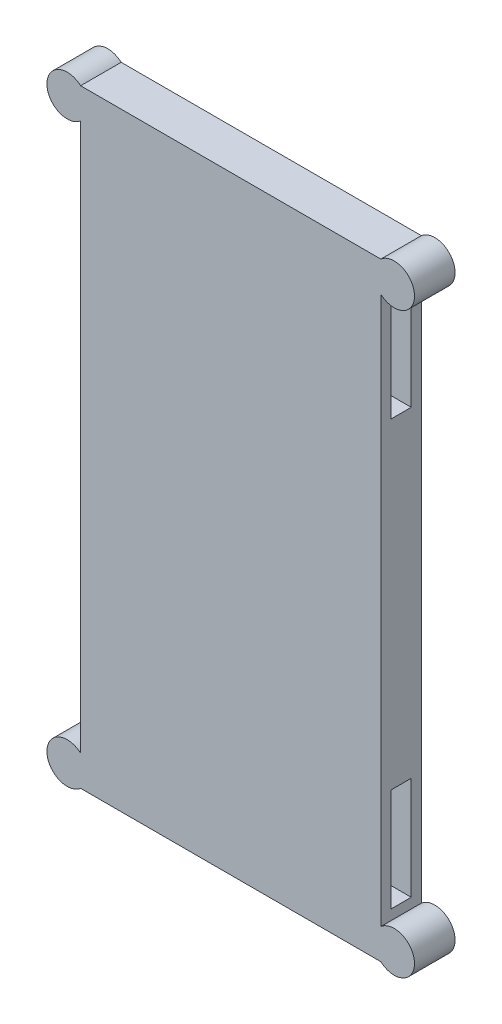
from build123d import *

# Parameters (mm, degrees)
SKETCH1_W           = 148
SKETCH1_H           = 300
BOSS_EXTRUDE1_DEPTH = 20
BOSS_EXTRUDE2_DEPTH = 20
SKETCH4_R           = 2.5
CUT_EXTRUDE2_DEPTH  = 10
CUT_EXTRUDE3_REACH  = 346.97
SKETCH5_W           = 10
SKETCH5_H           = 50.8
SKETCH7_W           = 13.921153846
SKETCH7_H           = 3.419230769
CUT_EXTRUDE4_DEPTH  = 5


with BuildPart() as part:
    # Sketch1 → Boss-Extrude1 (new body)
    with BuildSketch(Plane.XY):
        with Locations((74, 150)):
            Rectangle(SKETCH1_W, SKETCH1_H)
    extrude(amount=BOSS_EXTRUDE1_DEPTH)

    # Sketch3 → Boss-Extrude2 (add)
    with BuildSketch(Plane(origin=(0, 0, 0), x_dir=(-1, 0, 0), z_dir=(0, 0, -1))):
        with BuildLine():
            Line((0, 0), (0, 15))
            ThreePointArc((0, 15), (16.614378278, 7.5), (0, 0))
        make_face()
        with BuildLine():
            Line((-148, 0), (-148, 15))
            ThreePointArc((-148, 15), (-164.614378278, 7.5), (-148, 0))
        make_face()
        with BuildLine():
            Line((-148, 300), (-148, 285))
            ThreePointArc((-148, 285), (-164.614378278, 292.5), (-148, 300))
        make_face()
        with BuildLine():
            Line((0, 300), (0, 285))
            ThreePointArc((0, 285), (16.614378278, 292.5), (0, 300))
        make_face()
    extrude(amount=-BOSS_EXTRUDE2_DEPTH)

    # Sketch4 → Cut-Extrude2 (cut)
    with BuildSketch(Plane(origin=(0, 0, 0), x_dir=(-1, 0, 0), z_dir=(0, 0, -1))):
        with Locations((6.614378278, 7.5)):
            Circle(SKETCH4_R)
        with Locations((-154.614378278, 7.5)):
            Circle(SKETCH4_R)
        with Locations((-154.614378278, 292.5)):
            Circle(SKETCH4_R)
        with Locations((6.614378278, 292.5)):
            Circle(SKETCH4_R)
    extrude(amount=-CUT_EXTRUDE2_DEPTH, mode=Mode.SUBTRACT)

    # Sketch5 → Cut-Extrude3 (cut, up to next)
    with BuildSketch(Plane(origin=(148, 0, 0), x_dir=(0, 0, -1), z_dir=(1, 0, 0)), mode=Mode.PRIVATE) as cut_extrude3_sk1:
        with Locations((-10, 254.6)):
            Rectangle(SKETCH5_W, SKETCH5_H)
    cut_extrude3_tool1 = extrude(cut_extrude3_sk1.sketch, amount=-CUT_EXTRUDE3_REACH, mode=Mode.PRIVATE) & part.part
    # Sketch5 → Cut-Extrude3 (cut, up to next)
    with BuildSketch(Plane(origin=(148, 0, 0), x_dir=(0, 0, -1), z_dir=(1, 0, 0)), mode=Mode.PRIVATE) as cut_extrude3_sk2:
        with Locations((-10, 45.4)):
            Rectangle(SKETCH5_W, SKETCH5_H)
    cut_extrude3_tool2 = extrude(cut_extrude3_sk2.sketch, amount=-CUT_EXTRUDE3_REACH, mode=Mode.PRIVATE) & part.part
    add(cut_extrude3_tool1.solids().sort_by_distance((148, 254.6, 10))[0], mode=Mode.SUBTRACT)
    add(cut_extrude3_tool2.solids().sort_by_distance((148, 45.4, 10))[0], mode=Mode.SUBTRACT)

    # Sketch7 → Cut-Extrude4 (cut)
    # profile 1 of 9: a face of its own
    with BuildSketch(Plane(origin=(0, 0, 0), x_dir=(-1, 0, 0), z_dir=(0, 0, -1))):
        Polygon((-93.05, 102.863461538), (-93.05, 106.282692308), (-77.419230769, 106.282692308), (-77.419230769, 111.655769231), (-74, 111.655769231), (-74, 102.863461538), align=None)
    # profile 2 of 9: a face of its own
    with BuildSketch(Plane(origin=(0, 0, 0), x_dir=(-1, 0, 0), z_dir=(0, 0, -1))):
        with BuildLine():
            add(Edge.make_bspline(
                [(-93.782692308, 115.555829327), (-93.77554963, 115.703248556), (-93.761524294, 115.992720415), (-93.622067947, 116.405961185), (-93.410224894, 116.788787177), (-93.11106791, 117.123663252), (-92.755039073, 117.405017214), (-92.354069114, 117.616533357), (-91.911957927, 117.736721869), (-91.606943837, 117.753144754), (-91.451051683, 117.761538462)],
                knots=[0, 0, 0, 0, 0.989451283, 1.942882919, 2.90538868, 3.918974235, 4.943608841, 5.947266847, 6.950851762, 8, 8, 8, 8], degree=3))
            add(Edge.make_bspline(
                [(-91.451051683, 117.761538462), (-91.296406711, 117.753185623), (-90.993847324, 117.736843483), (-90.557395841, 117.616521461), (-90.160568566, 117.408267671), (-89.810493081, 117.127718929), (-89.517372558, 116.794803662), (-89.296196332, 116.422680626), (-89.165505232, 116.012074288), (-89.150119806, 115.727193377), (-89.142307692, 115.582542067)],
                knots=[0, 0, 0, 0, 1.052878812, 2.059933557, 3.056041729, 4.085953482, 5.099252665, 6.062359416, 7.016142401, 8, 8, 8, 8], degree=3))
            add(Edge.make_bspline(
                [(-89.142307692, 115.582542067), (-89.149599232, 115.433937151), (-89.163916458, 115.142145531), (-89.301585906, 114.72284999), (-89.522425405, 114.339628029), (-89.825413529, 114.003245964), (-90.183654835, 113.721876685), (-90.588872359, 113.515246638), (-91.032672705, 113.388510261), (-91.342082895, 113.373220756), (-91.500661058, 113.365384615)],
                knots=[0, 0, 0, 0, 0.989481277, 1.942885557, 2.912973099, 3.923546742, 4.946144057, 5.937372893, 6.942867345, 8, 8, 8, 8], degree=3))
            add(Edge.make_bspline(
                [(-91.500661058, 113.365384615), (-91.65274621, 113.373849729), (-91.951495536, 113.390478222), (-92.38313623, 113.510258509), (-92.774875041, 113.719099934), (-93.124245448, 113.996838953), (-93.416702005, 114.330246153), (-93.627314045, 114.710505337), (-93.759994158, 115.122281323), (-93.775048135, 115.40982113), (-93.782692308, 115.555829327)],
                knots=[0, 0, 0, 0, 1.038616768, 2.040212704, 3.031499824, 4.052181184, 5.074969369, 6.039807101, 7.004644834, 8, 8, 8, 8], degree=3))
        make_face()
    # profile 3 of 9: a face of its own
    with BuildSketch(Plane(origin=(0, 0, 0), x_dir=(-1, 0, 0), z_dir=(0, 0, -1))):
        with Locations((-80.960576923, 115.563461539)):
            Rectangle(SKETCH7_W, SKETCH7_H)
    # profile 4 of 9: a face of its own
    with BuildSketch(Plane(origin=(0, 0, 0), x_dir=(-1, 0, 0), z_dir=(0, 0, -1))):
        with BuildLine():
            Line((-87.921153846, 118.738461538), (-87.921153846, 119.959615385))
            add(Edge.make_bspline(
                [(-87.921153846, 119.959615385), (-88.142492377, 119.960431452), (-88.561013445, 119.961974524), (-89.153755707, 119.971087647), (-89.67534135, 119.977233074), (-90.125690144, 119.988210162), (-90.503482941, 120.003659244), (-90.808699091, 120.019496185), (-91.043264327, 120.031359117), (-91.175073425, 120.048084276), (-91.229717548, 120.055018029)],
                knots=[0, 0, 0, 0, 1.604323161, 3.033556972, 4.296844687, 5.385167547, 6.298701784, 7.037230881, 7.60086462, 8, 8, 8, 8], degree=3))
            add(Edge.make_bspline(
                [(-91.229717548, 120.055018029), (-91.417194642, 120.087531228), (-91.782650943, 120.150910456), (-92.292023019, 120.360716166), (-92.735744413, 120.665580775), (-93.048946429, 120.988755979), (-93.262761519, 121.288256541), (-93.402411804, 121.539512623), (-93.522134784, 121.812707831), (-93.616011951, 122.108724846), (-93.692697593, 122.424748357), (-93.746005649, 122.764188802), (-93.775383063, 123.125183896), (-93.780217059, 123.373705841), (-93.782692308, 123.500961538)],
                knots=[0, 0, 0, 0, 1.43722947, 2.801646624, 4.13175475, 5.486897933, 6.18427957, 6.91287343, 7.658885333, 8.438447905, 9.260561323, 10.118602268, 11.036630026, 12, 12, 12, 12], degree=3))
            add(Edge.make_bspline(
                [(-93.782692308, 123.500961538), (-93.776607767, 123.69593819), (-93.763934893, 124.102035344), (-93.661482502, 124.725970586), (-93.504644477, 125.387922346), (-93.358697321, 125.833576313), (-93.282782452, 126.065384615)],
                knots=[0, 0, 0, 0, 0.891275659, 1.856347963, 2.884972697, 4, 4, 4, 4], degree=3))
            Line((-93.282782452, 126.065384615), (-90.622956731, 126.065384615))
            add(Edge.make_bspline(
                [(-90.622956731, 126.065384615), (-90.657332936, 125.941050794), (-90.722896043, 125.70391841), (-90.795676916, 125.362722476), (-90.840618926, 125.055294591), (-90.848317933, 124.862161461), (-90.851923077, 124.77172476)],
                knots=[0, 0, 0, 0, 1.174725213, 2.24046353, 3.176077791, 4, 4, 4, 4], degree=3))
            add(Edge.make_bspline(
                [(-90.851923077, 124.77172476), (-90.850477897, 124.672034449), (-90.847766198, 124.484978062), (-90.789766349, 124.22859598), (-90.718128639, 124.005003631), (-90.62765172, 123.890849865), (-90.584795673, 123.836778846)],
                knots=[0, 0, 0, 0, 1.200739268, 2.253036902, 3.172518975, 4, 4, 4, 4], degree=3))
            add(Edge.make_bspline(
                [(-90.584795673, 123.836778846), (-90.542889653, 123.803973527), (-90.450305564, 123.731495858), (-90.261381717, 123.665618308), (-90.022598648, 123.632173009), (-89.845886811, 123.62629656), (-89.74906851, 123.623076923)],
                knots=[0, 0, 0, 0, 0.721105823, 1.593158367, 2.681320256, 4, 4, 4, 4], degree=3))
            Line((-89.74906851, 123.623076923), (-87.921153846, 123.611628606))
            Line((-87.921153846, 123.611628606), (-87.921153846, 125.821153846))
            Line((-87.921153846, 125.821153846), (-84.990384615, 125.821153846))
            Line((-84.990384615, 125.821153846), (-84.990384615, 123.378846154))
            Line((-84.990384615, 123.378846154), (-74, 123.378846154))
            Line((-74, 123.378846154), (-74, 119.959615385))
            Line((-74, 119.959615385), (-84.990384615, 119.959615385))
            Line((-84.990384615, 119.959615385), (-84.990384615, 118.738461538))
            Line((-84.990384615, 118.738461538), (-87.921153846, 118.738461538))
        make_face()
    # profile 5 of 9: a face of its own
    with BuildSketch(Plane(origin=(0, 0, 0), x_dir=(-1, 0, 0), z_dir=(0, 0, -1))):
        Polygon((-93.538461538, 128.019230769), (-93.538461538, 131.438461538), (-87.921153846, 131.438461538), (-87.921153846, 133.636538462), (-84.990384615, 133.636538462), (-84.990384615, 131.438461538), (-74, 131.438461538), (-74, 128.019230769), (-84.990384615, 128.019230769), (-84.990384615, 126.309615385), (-87.921153846, 126.309615385), (-87.921153846, 128.019230769), align=None)
    # profile 6 of 9: a face of its own
    with BuildSketch(Plane(origin=(0, 0, 0), x_dir=(-1, 0, 0), z_dir=(0, 0, -1))):
        Polygon((-93.05, 143.405769231), (-93.05, 146.825), (-77.419230769, 146.825), (-77.419230769, 152.198076923), (-74, 152.198076923), (-74, 143.405769231), align=None)
    # profile 7 of 9: a face of its own
    with BuildSketch(Plane(origin=(0, 0, 0), x_dir=(-1, 0, 0), z_dir=(0, 0, -1))):
        with BuildLine():
            Line((-87.921153846, 165.142307692), (-87.921153846, 168.561538462))
            Line((-87.921153846, 168.561538462), (-74, 168.561538462))
            Line((-74, 168.561538462), (-74, 165.142307692))
            Line((-74, 165.142307692), (-75.518810096, 165.142307692))
            add(Edge.make_bspline(
                [(-75.518810096, 165.142307692), (-75.371392836, 164.972595238), (-75.084796571, 164.642654526), (-74.706740062, 164.128384876), (-74.405546936, 163.605056585), (-74.15977222, 163.082901107), (-73.979547833, 162.546984182), (-73.848687137, 161.995442929), (-73.771602974, 161.419963803), (-73.761102122, 161.02877479), (-73.755769231, 160.830108173)],
                knots=[0, 0, 0, 0, 1.129123921, 2.195147974, 3.200207348, 4.157999811, 5.089597333, 6.035096005, 7.002117093, 8, 8, 8, 8], degree=3))
            add(Edge.make_bspline(
                [(-73.755769231, 160.830108173), (-73.760784318, 160.607093377), (-73.770694415, 160.1664035), (-73.875085276, 159.519763722), (-74.034726163, 158.895276557), (-74.261194496, 158.293888182), (-74.552910765, 157.714427002), (-74.910974186, 157.160147285), (-75.328910692, 156.625238765), (-75.811014704, 156.124872783), (-76.33489097, 155.660665192), (-76.899908199, 155.258312203), (-77.494758934, 154.91533794), (-78.122199716, 154.637588792), (-78.779999865, 154.417875677), (-79.470018211, 154.261473004), (-80.192287817, 154.169141803), (-80.684277735, 154.157718246), (-80.933864183, 154.151923077)],
                knots=[0, 0, 0, 0, 0.980565623, 1.937653242, 2.874408941, 3.813202629, 4.759425872, 5.723639668, 6.712366934, 7.741707894, 8.776921788, 9.78808311, 10.788528848, 11.79333378, 12.802261723, 13.835597484, 14.901998771, 16, 16, 16, 16], degree=3))
            add(Edge.make_bspline(
                [(-80.933864183, 154.151923077), (-81.192312715, 154.158001476), (-81.69928831, 154.169924932), (-82.443214175, 154.257283854), (-83.150414761, 154.410610395), (-83.822343029, 154.621270516), (-84.45920403, 154.887570855), (-85.058434612, 155.218756917), (-85.622185676, 155.610169701), (-86.144232665, 156.057215131), (-86.615906082, 156.547842385), (-87.028803622, 157.068515405), (-87.386243046, 157.611768822), (-87.666802396, 158.18828244), (-87.890028257, 158.786281862), (-88.051677909, 159.409906506), (-88.149070943, 160.059975622), (-88.159901564, 160.502860709), (-88.165384615, 160.727073317)],
                knots=[0, 0, 0, 0, 1.136200099, 2.228783096, 3.287341693, 4.313263682, 5.320819933, 6.317074962, 7.317731395, 8.33320375, 9.333922696, 10.3051871, 11.251461974, 12.186899125, 13.117710514, 14.053682506, 15.014667834, 16, 16, 16, 16], degree=3))
            add(Edge.make_bspline(
                [(-88.165384615, 160.727073317), (-88.161178611, 160.934787202), (-88.152856445, 161.345778109), (-88.058625072, 161.94915488), (-87.924375498, 162.536008597), (-87.724274506, 163.100916622), (-87.466819985, 163.646611196), (-87.151846181, 164.169196977), (-86.784842844, 164.675673538), (-86.498550128, 164.984841187), (-86.352734375, 165.142307692)],
                knots=[0, 0, 0, 0, 1.016860689, 2.012000776, 2.985574089, 3.963288254, 4.94189597, 5.937036056, 6.949282938, 8, 8, 8, 8], degree=3))
            Line((-86.352734375, 165.142307692), (-87.921153846, 165.142307692))
        make_face()
        with BuildLine():
            add(Edge.make_bspline(
                [(-84.990384615, 161.444501202), (-84.986202289, 161.308256027), (-84.978005201, 161.04122438), (-84.928746385, 160.6484992), (-84.841810266, 160.273243171), (-84.713863482, 159.917798469), (-84.556603259, 159.578690095), (-84.366051649, 159.255846371), (-84.13379569, 158.953901808), (-83.872607386, 158.669842858), (-83.585158405, 158.40912686), (-83.268999638, 158.189904266), (-82.939328677, 157.995261178), (-82.587519999, 157.838255479), (-82.21399635, 157.722025128), (-81.82290593, 157.631329251), (-81.410756266, 157.584039086), (-81.129857572, 157.575491902), (-80.987289663, 157.571153846)],
                knots=[0, 0, 0, 0, 1.048146026, 2.054297773, 3.039291333, 4.004895774, 4.954855183, 5.911393651, 6.882091317, 7.879305688, 8.877191939, 9.859995919, 10.833402353, 11.818978979, 12.815424932, 13.838562528, 14.902979527, 16, 16, 16, 16], degree=3))
            add(Edge.make_bspline(
                [(-80.987289663, 157.571153846), (-80.843430279, 157.575429408), (-80.55995703, 157.583854353), (-80.144306572, 157.632049119), (-79.747591057, 157.719669063), (-79.373326442, 157.847931965), (-79.016350567, 158.002642833), (-78.680406457, 158.19677967), (-78.3640117, 158.425035994), (-78.071347473, 158.688691957), (-77.806057934, 158.976589025), (-77.572292081, 159.283158817), (-77.370465062, 159.604755835), (-77.212571052, 159.945833693), (-77.082755679, 160.299787322), (-76.99709838, 160.672929751), (-76.942254396, 161.061263859), (-76.934624055, 161.326014454), (-76.930769231, 161.459765625)],
                knots=[0, 0, 0, 0, 1.099325991, 2.166209118, 3.191924645, 4.196940947, 5.184751095, 6.160002295, 7.155385631, 8.160260941, 9.164478025, 10.142244259, 11.102414478, 12.058888405, 13.008821923, 13.977708232, 14.978344536, 16, 16, 16, 16], degree=3))
            add(Edge.make_bspline(
                [(-76.930769231, 161.459765625), (-76.93497129, 161.59855077), (-76.943209609, 161.870645099), (-76.992071014, 162.26974571), (-77.079134418, 162.650158255), (-77.208509965, 163.009957183), (-77.362633218, 163.356494087), (-77.559826149, 163.681291632), (-77.789483921, 163.988531489), (-78.053706474, 164.272501667), (-78.339604472, 164.536995589), (-78.657276618, 164.761910433), (-78.992476752, 164.959336251), (-79.353704778, 165.114343574), (-79.734280412, 165.237512125), (-80.136664303, 165.325864547), (-80.56126302, 165.373927333), (-80.851069254, 165.382281602), (-80.998737981, 165.386538462)],
                knots=[0, 0, 0, 0, 1.050155102, 2.058874885, 3.037059141, 3.995876228, 4.947712252, 5.901735345, 6.864168349, 7.84500044, 8.832936864, 9.80518476, 10.78407896, 11.771077351, 12.772424026, 13.806938781, 14.882541092, 16, 16, 16, 16], degree=3))
            add(Edge.make_bspline(
                [(-80.998737981, 165.386538462), (-81.143868587, 165.382338429), (-81.42735082, 165.374134546), (-81.843060184, 165.325613918), (-82.237629891, 165.236833499), (-82.612354272, 165.115124392), (-82.967104538, 164.959307623), (-83.295073748, 164.760753919), (-83.608541831, 164.537087724), (-83.890009283, 164.272091671), (-84.15254531, 163.989348278), (-84.371615534, 163.676637174), (-84.56526991, 163.351668408), (-84.72335749, 163.006789168), (-84.839544175, 162.640755959), (-84.929417163, 162.259735073), (-84.97798232, 161.857878622), (-84.986183053, 161.584542292), (-84.990384615, 161.444501202)],
                knots=[0, 0, 0, 0, 1.106392033, 2.161105042, 3.184375597, 4.183944285, 5.160535686, 6.12997743, 7.101598623, 8.089721671, 9.071306002, 10.0372504, 10.99341283, 11.95232427, 12.921232515, 13.916134811, 14.932352853, 16, 16, 16, 16], degree=3))
        make_face(mode=Mode.SUBTRACT)
    # profile 8 of 9: a face of its own
    with BuildSketch(Plane(origin=(0, 0, 0), x_dir=(-1, 0, 0), z_dir=(0, 0, -1))):
        with BuildLine():
            Line((-93.538461538, 175.4), (-86.299308894, 175.4))
            add(Edge.make_bspline(
                [(-86.299308894, 175.4), (-86.448806689, 175.558772741), (-86.74227882, 175.870452087), (-87.121719628, 176.379349125), (-87.442158859, 176.906459237), (-87.710285864, 177.451524838), (-87.910996659, 178.018366543), (-88.057453381, 178.60339529), (-88.147214114, 179.206976155), (-88.159296098, 179.616495861), (-88.165384615, 179.822866587)],
                knots=[0, 0, 0, 0, 1.061273251, 2.083335899, 3.084058773, 4.061996401, 5.035766215, 6.006279825, 6.995297484, 8, 8, 8, 8], degree=3))
            add(Edge.make_bspline(
                [(-88.165384615, 179.822866587), (-88.160022384, 180.047100512), (-88.149460528, 180.488768587), (-88.050567852, 181.138521447), (-87.891373478, 181.761493382), (-87.666969751, 182.358103415), (-87.383924179, 182.931681472), (-87.031433645, 183.476945021), (-86.61432493, 183.994503869), (-86.144489763, 184.485307664), (-85.62207643, 184.931978398), (-85.058613584, 185.323967835), (-84.458158971, 185.653464642), (-83.824066544, 185.92700616), (-83.149495395, 186.130137046), (-82.443367796, 186.285482715), (-81.699247585, 186.372261111), (-81.192298964, 186.384265141), (-80.933864183, 186.390384615)],
                knots=[0, 0, 0, 0, 0.985918914, 1.941940352, 2.883887689, 3.810010177, 4.7409891, 5.692528817, 6.659995536, 7.661310393, 8.677387444, 9.67863975, 10.675488032, 11.68583178, 12.710700752, 13.769889703, 14.863123313, 16, 16, 16, 16], degree=3))
            add(Edge.make_bspline(
                [(-80.933864183, 186.390384615), (-80.684277742, 186.384589441), (-80.192287837, 186.373165874), (-79.470018135, 186.280834747), (-78.780000138, 186.124431806), (-78.122198724, 185.904719664), (-77.494762615, 185.626966918), (-76.899894463, 185.284006067), (-76.334943374, 184.881602145), (-75.810814495, 184.417589089), (-75.33033338, 183.917228999), (-74.90960616, 183.385744961), (-74.554219878, 182.832247865), (-74.260246632, 182.255298986), (-74.034122004, 181.653500566), (-73.876087807, 181.028701893), (-73.770330503, 180.382333127), (-73.760671331, 179.942865001), (-73.755769231, 179.719831731)],
                knots=[0, 0, 0, 0, 1.098654079, 2.165689428, 3.19963959, 4.209167422, 5.21456979, 6.215610373, 7.227372913, 8.263202325, 9.29315531, 10.278069275, 11.242856373, 12.184642801, 13.123994677, 14.066729874, 15.018851352, 16, 16, 16, 16], degree=3))
            add(Edge.make_bspline(
                [(-73.755769231, 179.719831731), (-73.761082171, 179.52116164), (-73.771543736, 179.129965787), (-73.849078815, 178.553306517), (-73.97962701, 177.999236573), (-74.158937623, 177.460383192), (-74.405638212, 176.937283844), (-74.706713593, 176.413913323), (-75.084803819, 175.899655766), (-75.371395298, 175.569713337), (-75.518810096, 175.4)],
                knots=[0, 0, 0, 0, 0.996354537, 1.961894523, 2.912155913, 3.848368634, 4.80469413, 5.808214142, 6.872605459, 8, 8, 8, 8], degree=3))
            Line((-75.518810096, 175.4), (-74, 175.4))
            Line((-74, 175.4), (-74, 171.980769231))
            Line((-74, 171.980769231), (-93.538461538, 171.980769231))
            Line((-93.538461538, 171.980769231), (-93.538461538, 175.4))
        make_face()
        with BuildLine():
            add(Edge.make_bspline(
                [(-84.990384615, 179.082542067), (-84.986118008, 178.943779162), (-84.977753137, 178.671728432), (-84.929803016, 178.272313858), (-84.839618511, 177.893840829), (-84.722620139, 177.5306519), (-84.565100287, 177.186991751), (-84.373052027, 176.86201823), (-84.14970502, 176.552810593), (-83.893082017, 176.265829686), (-83.605537706, 176.006355771), (-83.297751384, 175.776316446), (-82.965671995, 175.584069155), (-82.612586607, 175.426816321), (-82.23756546, 175.305575964), (-81.843078103, 175.216665471), (-81.427346024, 175.168180721), (-81.143866963, 175.159971828), (-80.998737981, 175.155769231)],
                knots=[0, 0, 0, 0, 1.06026186, 2.078689624, 3.066287985, 4.028070226, 4.989066778, 5.947308343, 6.907469395, 7.898408277, 8.88212702, 9.861613455, 10.828242951, 11.806957908, 12.808700115, 13.834195728, 14.891202165, 16, 16, 16, 16], degree=3))
            add(Edge.make_bspline(
                [(-80.998737981, 175.155769231), (-80.851070867, 175.160028692), (-80.561267797, 175.168388069), (-80.136646316, 175.216414117), (-79.734344201, 175.304898515), (-79.353476196, 175.427595212), (-78.993895774, 175.584070183), (-78.654625711, 175.775125572), (-78.342551166, 176.006447379), (-78.05081227, 176.265508954), (-77.79099561, 176.553956883), (-77.559577232, 176.86077095), (-77.362699478, 177.185878853), (-77.208492096, 177.532332915), (-77.079139322, 177.892154266), (-76.992069651, 178.27256064), (-76.943209971, 178.671662949), (-76.934971412, 178.943757043), (-76.930769231, 179.082542067)],
                knots=[0, 0, 0, 0, 1.117352564, 2.192852514, 3.227268818, 4.228520199, 5.215424661, 6.189435882, 7.167242953, 8.148642482, 9.136484888, 10.098826301, 11.052758603, 12.004504044, 12.963229885, 13.94132105, 14.949944837, 16, 16, 16, 16], degree=3))
            add(Edge.make_bspline(
                [(-76.930769231, 179.082542067), (-76.934672917, 179.216278821), (-76.942399977, 179.481000877), (-76.996366391, 179.868315369), (-77.08441919, 180.240692721), (-77.210397809, 180.594879372), (-77.373001758, 180.934877993), (-77.569634859, 181.258399099), (-77.807620695, 181.56202582), (-78.071151413, 181.849894577), (-78.363904676, 182.113704146), (-78.681536751, 182.341016838), (-79.015167559, 182.54044029), (-79.373489699, 182.694093749), (-79.747546059, 182.822716349), (-80.144319206, 182.910236753), (-80.559953706, 182.95845908), (-80.84342916, 182.966880217), (-80.987289663, 182.971153846)],
                knots=[0, 0, 0, 0, 1.021887628, 2.02275132, 2.982401445, 3.941706841, 4.889615714, 5.858283278, 6.828559237, 7.833004523, 8.838108184, 9.833717713, 10.814070705, 11.802105327, 12.807350012, 13.833298626, 14.900424194, 16, 16, 16, 16], degree=3))
            add(Edge.make_bspline(
                [(-80.987289663, 182.971153846), (-81.129857572, 182.966815791), (-81.410756267, 182.958268607), (-81.822905927, 182.91097844), (-82.213996362, 182.82028257), (-82.587519958, 182.704052193), (-82.939328828, 182.547046589), (-83.26899908, 182.352403151), (-83.585160526, 182.133181878), (-83.872599342, 181.872460867), (-84.133825334, 181.588420508), (-84.365944947, 181.286408686), (-84.557583772, 180.962814972), (-84.713808494, 180.620566301), (-84.841177436, 180.262501702), (-84.929244714, 179.884986214), (-84.977907526, 179.489601838), (-84.986169726, 179.220051047), (-84.990384615, 179.082542067)],
                knots=[0, 0, 0, 0, 1.094449365, 2.156371669, 3.177111318, 4.171221881, 5.154488592, 6.125613636, 7.106114198, 8.101661685, 9.096538865, 10.064961488, 11.019258098, 11.975848813, 12.948395745, 13.931080756, 14.94455893, 16, 16, 16, 16], degree=3))
        make_face(mode=Mode.SUBTRACT)
    # profile 9 of 9: a face of its own
    with BuildSketch(Plane(origin=(0, 0, 0), x_dir=(-1, 0, 0), z_dir=(0, 0, -1))):
        with BuildLine():
            Line((-85.772686298, 197.869230769), (-83.525, 195.778004808))
            add(Edge.make_bspline(
                [(-83.525, 195.778004808), (-83.640551847, 195.673579877), (-83.86155876, 195.473854542), (-84.162840576, 195.168094356), (-84.413719329, 194.866887536), (-84.624467937, 194.575847047), (-84.786086927, 194.289028804), (-84.902368171, 194.00881691), (-84.976185233, 193.73507692), (-84.985740573, 193.553630482), (-84.990384615, 193.465444712)],
                knots=[0, 0, 0, 0, 1.327646587, 2.539285, 3.655602211, 4.666613517, 5.598770349, 6.454635452, 7.248928967, 8, 8, 8, 8], degree=3))
            add(Edge.make_bspline(
                [(-84.990384615, 193.465444712), (-84.987665034, 193.37620957), (-84.982457881, 193.205352033), (-84.937793574, 192.964233762), (-84.860471425, 192.75239523), (-84.755074131, 192.573142314), (-84.625235489, 192.429127348), (-84.476703147, 192.328295754), (-84.314096808, 192.260586412), (-84.198591244, 192.25485864), (-84.139393029, 192.251923077)],
                knots=[0, 0, 0, 0, 1.295068245, 2.479652818, 3.543291146, 4.55379989, 5.481948265, 6.332409746, 7.145336708, 8, 8, 8, 8], degree=3))
            add(Edge.make_bspline(
                [(-84.139393029, 192.251923077), (-84.049682147, 192.261869034), (-83.86354249, 192.282505739), (-83.647648258, 192.424251286), (-83.488387503, 192.61179088), (-83.340186226, 192.827969806), (-83.174481329, 193.120732036), (-83.061018346, 193.342828895), (-82.998377404, 193.465444712)],
                knots=[0, 0, 0, 0, 0.916701701, 1.902049539, 2.5493345, 3.440293453, 4.586830489, 6, 6, 6, 6], degree=3))
            Line((-82.998377404, 193.465444712), (-82.372536058, 194.701862981))
            add(Edge.make_bspline(
                [(-82.372536058, 194.701862981), (-82.292701613, 194.859184605), (-82.137807794, 195.164418109), (-81.887275035, 195.593130956), (-81.646170357, 195.991233211), (-81.392181454, 196.342688327), (-81.14724888, 196.663625588), (-80.892247729, 196.938303573), (-80.642131872, 197.180654217), (-80.306309031, 197.450585834), (-79.85917605, 197.720696533), (-79.277635282, 197.945849155), (-78.654950156, 198.089435225), (-78.223963148, 198.105320699), (-78.003094952, 198.113461538)],
                knots=[0, 0, 0, 0, 1.076723934, 2.08904669, 3.030727471, 3.916304557, 4.734969869, 5.493452046, 6.201990317, 6.859314016, 8.120513813, 9.372210561, 10.65333501, 12, 12, 12, 12], degree=3))
            add(Edge.make_bspline(
                [(-78.003094952, 198.113461538), (-77.854090143, 198.108552447), (-77.562448189, 198.098944051), (-77.133143291, 198.038309647), (-76.72507586, 197.929078763), (-76.332295252, 197.786776888), (-75.96311782, 197.591355315), (-75.612127979, 197.358083102), (-75.276233455, 197.085549972), (-74.966569894, 196.768749494), (-74.67973339, 196.419741615), (-74.430838389, 196.037328836), (-74.225503187, 195.624822296), (-74.051617271, 195.187706372), (-73.918685067, 194.719633375), (-73.824599423, 194.222837803), (-73.765932907, 193.697086815), (-73.759214651, 193.337127262), (-73.755769231, 193.152524038)],
                knots=[0, 0, 0, 0, 0.976822692, 1.911901239, 2.834103221, 3.741677305, 4.644181532, 5.564572461, 6.500876952, 7.4737059, 8.463396961, 9.457853255, 10.457191201, 11.479092582, 12.537356171, 13.641151563, 14.790277904, 16, 16, 16, 16], degree=3))
            add(Edge.make_bspline(
                [(-73.755769231, 193.152524038), (-73.76355807, 192.907933817), (-73.778846877, 192.427824747), (-73.885346518, 191.726660208), (-74.069699191, 191.064574738), (-74.327953705, 190.441023623), (-74.657040753, 189.8521877), (-75.06536574, 189.306476207), (-75.542290079, 188.794428737), (-75.908068836, 188.496514199), (-76.095042067, 188.344230769)],
                knots=[0, 0, 0, 0, 1.056901255, 2.07460411, 3.05625841, 4.019970729, 4.984811261, 5.963335951, 6.958928997, 8, 8, 8, 8], degree=3))
            Line((-76.095042067, 188.344230769), (-78.396153846, 190.416376202))
            add(Edge.make_bspline(
                [(-78.396153846, 190.416376202), (-78.290011038, 190.517617472), (-78.078688552, 190.719181357), (-77.794826146, 191.053079531), (-77.546320648, 191.414644994), (-77.331188609, 191.793824471), (-77.161534096, 192.176413851), (-77.024325137, 192.539685523), (-76.950626271, 192.884992466), (-76.93716582, 193.107732592), (-76.930769231, 193.213581731)],
                knots=[0, 0, 0, 0, 1.087612404, 2.16535591, 3.243760151, 4.338105798, 5.393939541, 6.346052752, 7.214021764, 8, 8, 8, 8], degree=3))
            add(Edge.make_bspline(
                [(-76.930769231, 193.213581731), (-76.933837263, 193.31947455), (-76.939734868, 193.523029773), (-77.001040024, 193.812365826), (-77.104187577, 194.068705479), (-77.246929807, 194.286474554), (-77.410956738, 194.465531394), (-77.595147398, 194.596723015), (-77.79447341, 194.678046631), (-77.933694454, 194.688846918), (-78.003094952, 194.694230769)],
                knots=[0, 0, 0, 0, 1.254755047, 2.411985499, 3.488053563, 4.513519474, 5.48505018, 6.351651985, 7.178312628, 8, 8, 8, 8], degree=3))
            add(Edge.make_bspline(
                [(-78.003094952, 194.694230769), (-78.06854812, 194.689635669), (-78.202936092, 194.680201043), (-78.401302353, 194.605506804), (-78.59771678, 194.488235378), (-78.792733156, 194.32558631), (-78.984769152, 194.115395346), (-79.172286624, 193.858414706), (-79.36528986, 193.560572941), (-79.480486946, 193.340570061), (-79.540985577, 193.225030048)],
                knots=[0, 0, 0, 0, 0.704666567, 1.446816302, 2.258757648, 3.165368109, 4.175243826, 5.322435858, 6.59381024, 8, 8, 8, 8], degree=3))
            Line((-79.540985577, 193.225030048), (-80.113401442, 192.091646635))
            add(Edge.make_bspline(
                [(-80.113401442, 192.091646635), (-80.251266926, 191.834550032), (-80.515916963, 191.341020949), (-80.969735536, 190.673954121), (-81.452834439, 190.109378353), (-81.962618298, 189.646833561), (-82.497656539, 189.278276955), (-83.064761244, 189.021183995), (-83.658556134, 188.85944904), (-84.064599522, 188.841655607), (-84.269140625, 188.832692308)],
                knots=[0, 0, 0, 0, 1.255999728, 2.41104856, 3.467751088, 4.449286722, 5.368722015, 6.253902015, 7.120417131, 8, 8, 8, 8], degree=3))
            add(Edge.make_bspline(
                [(-84.269140625, 188.832692308), (-84.401707921, 188.835795465), (-84.661959061, 188.841887467), (-85.044104825, 188.906924775), (-85.411643439, 189.004790205), (-85.765261318, 189.144734891), (-86.106771909, 189.318399593), (-86.428402607, 189.540965643), (-86.739623117, 189.796601881), (-87.030453781, 190.09265781), (-87.295329824, 190.418991211), (-87.531180452, 190.767194243), (-87.7258033, 191.140606106), (-87.886454953, 191.535458025), (-88.013020699, 191.951674386), (-88.099416466, 192.390257045), (-88.15426776, 192.84966406), (-88.161626491, 193.1638124), (-88.165384615, 193.324248798)],
                knots=[0, 0, 0, 0, 0.958838075, 1.882354927, 2.798264616, 3.708042778, 4.63064089, 5.565475101, 6.533511613, 7.542848948, 8.564005966, 9.572881083, 10.582092379, 11.606441752, 12.655212552, 13.726187313, 14.838757778, 16, 16, 16, 16], degree=3))
            add(Edge.make_bspline(
                [(-88.165384615, 193.324248798), (-88.158614216, 193.546164902), (-88.145169267, 193.986855363), (-88.020032965, 194.634358397), (-87.830666157, 195.263522656), (-87.557077368, 195.865812615), (-87.216296873, 196.437546697), (-86.801621722, 196.964845456), (-86.324184227, 197.451538871), (-85.958344437, 197.728617548), (-85.772686298, 197.869230769)],
                knots=[0, 0, 0, 0, 0.996674327, 1.979238371, 2.954234801, 3.944803944, 4.945146381, 5.93922524, 6.954188099, 8, 8, 8, 8], degree=3))
        make_face()
    extrude(amount=-CUT_EXTRUDE4_DEPTH, mode=Mode.SUBTRACT)


solid = part.part
